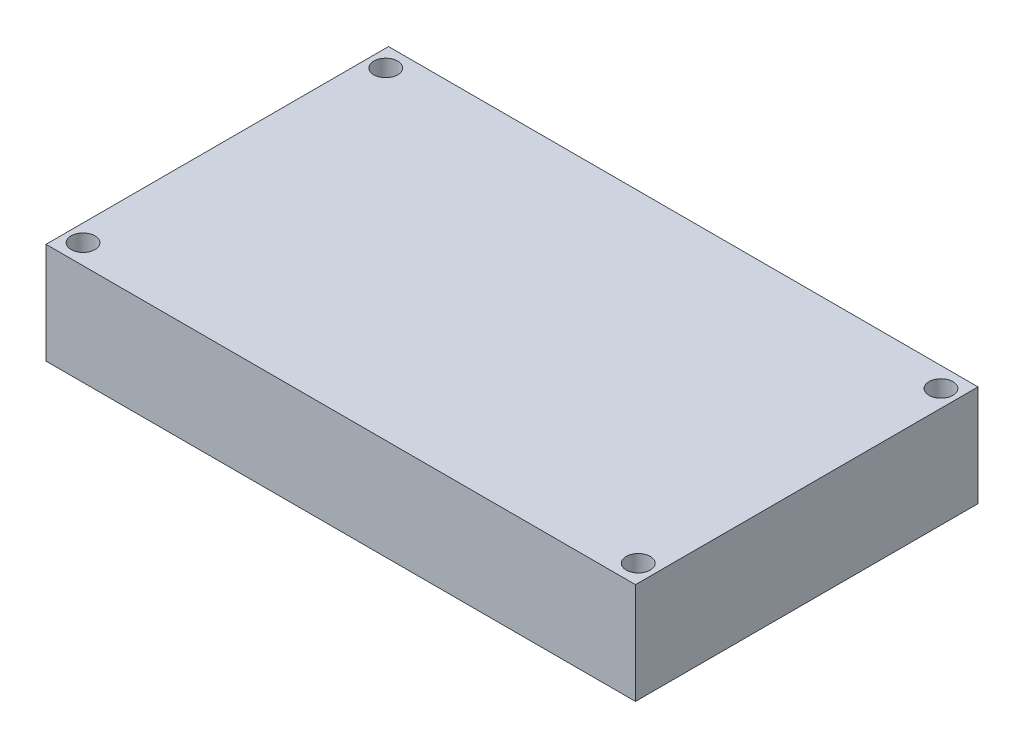
from build123d import *

# Parameters (mm, degrees)
SKETCH1_W           = 74
SKETCH1_H           = 43
SKETCH1_R           = 1.5
BOSS_EXTRUDE1_DEPTH = 12.7


with BuildPart() as part:
    # Sketch1 → Boss-Extrude1 (new body)
    with BuildSketch(Plane(origin=(0, 0, 0), x_dir=(1, 0, 0), z_dir=(0, 1, 0))):
        with Locations((37, 21.5)):
            Rectangle(SKETCH1_W, SKETCH1_H)
        with Locations(Location((2.15, 40.5, 0), (0, 0, 270))):
            Circle(SKETCH1_R, mode=Mode.SUBTRACT)
        with Locations(Location((71.85, 40.5, 0), (0, 0, 270))):
            Circle(SKETCH1_R, mode=Mode.SUBTRACT)
        with Locations(Location((71.85, 2.5, 0), (0, 0, 270))):
            Circle(SKETCH1_R, mode=Mode.SUBTRACT)
        with Locations(Location((2.15, 2.5, 0), (0, 0, 270))):
            Circle(SKETCH1_R, mode=Mode.SUBTRACT)
    extrude(amount=BOSS_EXTRUDE1_DEPTH)


solid = part.part
